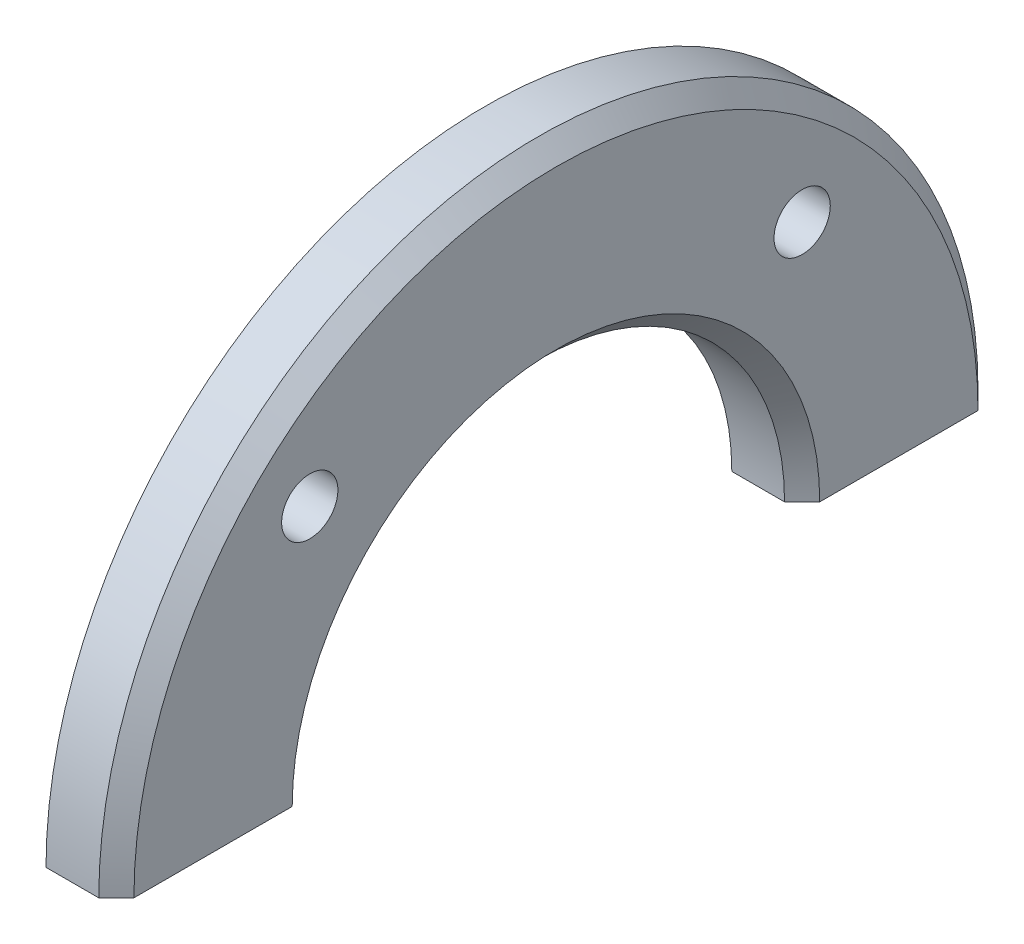
from build123d import *

# Parameters (mm, degrees)
SKETCH1_R           = 1.6
BOSS_EXTRUDE1_DEPTH = 4
CHAMFER1_SIZE       = 1


with BuildPart() as part:
    # Sketch1 → Boss-Extrude1 (new body)
    with BuildSketch(Plane(origin=(0, 0, 0), x_dir=(0, 0, -1), z_dir=(1, 0, 0))):
        with BuildLine():
            Line((14, 0), (25, 0))
            ThreePointArc((25, 0), (0, 25), (-25, 0))
            Line((-25, 0), (-14, 0))
            ThreePointArc((-14, 0), (0, 14), (14, 0))
        make_face()
        with Locations((14, 14.282856857)):
            Circle(SKETCH1_R, mode=Mode.SUBTRACT)
        with Locations((-14, 14.282856857)):
            Circle(SKETCH1_R, mode=Mode.SUBTRACT)
    extrude(amount=BOSS_EXTRUDE1_DEPTH)

    # Chamfer1
    chamfer1_edges = [part.edges().sort_by_distance(p)[0] for p in [
        (4, 25, 0),
        (4, 14, 0),
    ]]
    chamfer(chamfer1_edges, length=CHAMFER1_SIZE)


solid = part.part
